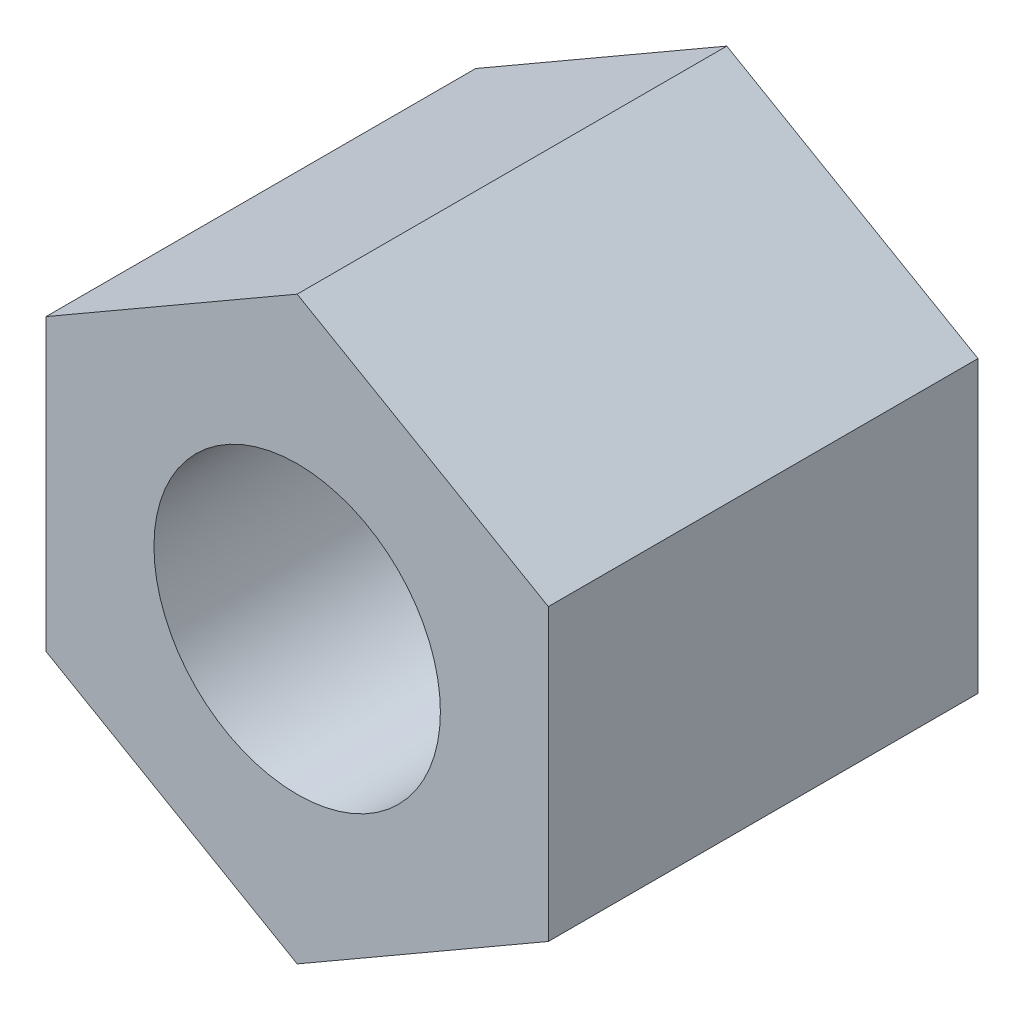
from build123d import *

# Parameters (mm, degrees)
SKETCH_1_R      = 2
EXTRUDE_1_DEPTH = 6


with BuildPart() as part:
    # 草图1 → 凸台-拉伸1 (new body)
    with BuildSketch(Plane.XY):
        Polygon((0, 4.05), (-3.507402885, 2.025), (-3.507402885, -2.025), (0, -4.05), (3.507402885, -2.025), (3.507402885, 2.025), align=None)
        Circle(SKETCH_1_R, mode=Mode.SUBTRACT)
    extrude(amount=EXTRUDE_1_DEPTH)


solid = part.part
